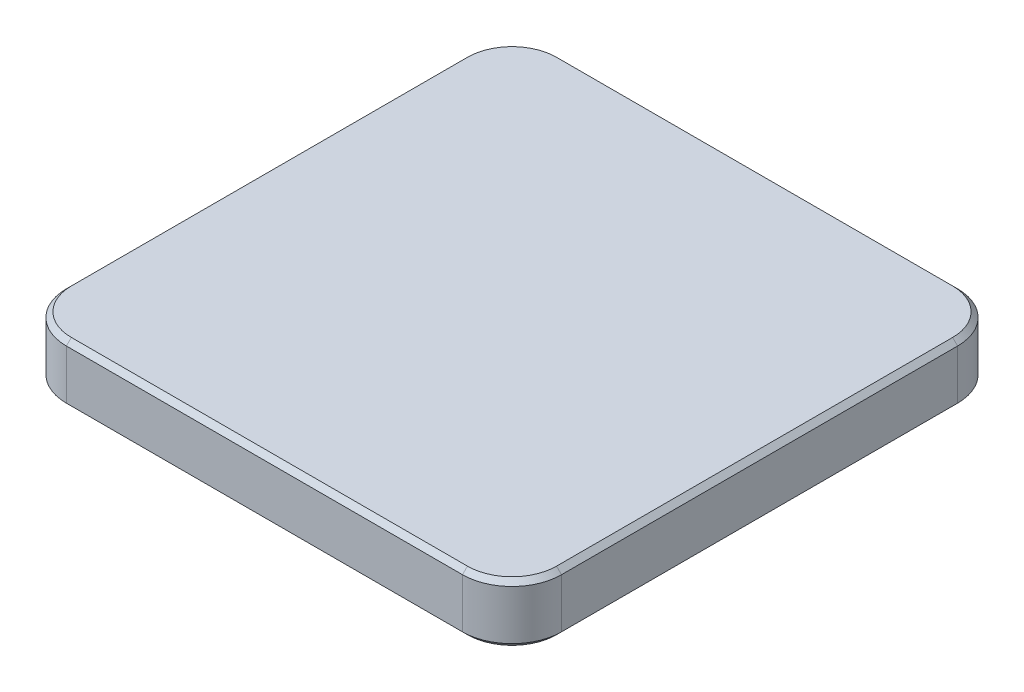
from build123d import *

# Parameters (mm, degrees)
SKETCH_1_W      = 100
SKETCH_1_H      = 100
EXTRUDE_1_DEPTH = 12
FILLET_1_R      = 10
CHAMFER_1_SIZE  = 1


with BuildPart() as part:
    # 草圖1 → 擠出1 (new body)
    with BuildSketch(Plane(origin=(0, 0, 0), x_dir=(-1, 0, 0), z_dir=(0, 1, 0))):
        Rectangle(SKETCH_1_W, SKETCH_1_H)
    extrude(amount=EXTRUDE_1_DEPTH)

    # 圓角1
    fillet_1_edges = [part.edges().sort_by_distance(p)[0] for p in [
        (-50, 6, -50),
        (50, 6, -50),
        (50, 6, 50),
        (-50, 6, 50),
    ]]
    fillet(fillet_1_edges, radius=FILLET_1_R)

    # 倒角1
    chamfer_1_edges = [part.edges().sort_by_distance(p)[0] for p in [
        (0, 0, 50),
        (0, 12, 50),
        (-50, 0, 0),
        (0, 0, -50),
        (50, 0, 0),
        (47.071067812, 0, 47.071067812),
        (-47.071067812, 0, -47.071067812),
        (47.071067812, 0, -47.071067812),
        (-47.071067812, 0, 47.071067812),
        (-50, 12, 0),
        (50, 12, 0),
        (0, 12, -50),
        (47.071067812, 12, 47.071067812),
        (-47.071067812, 12, -47.071067812),
        (47.071067812, 12, -47.071067812),
        (-47.071067812, 12, 47.071067812),
    ]]
    chamfer(chamfer_1_edges, length=CHAMFER_1_SIZE)


solid = part.part
